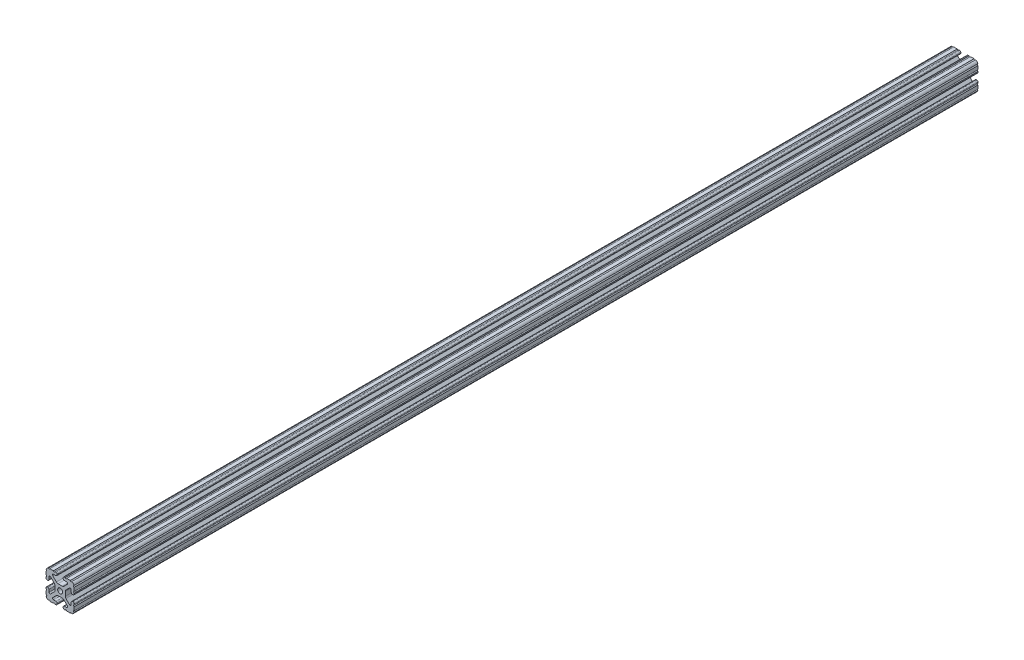
from build123d import *

# Parameters (mm, degrees)
BOSS_EXTRUDE1_DEPTH     = 609.6
CUT_EXTRUDE1_DEPTH      = 611.195022104
CUT_EXTRUDE1_DEPTH_BACK = 611.195022104
SKETCH5_R               = 1.016


with BuildPart() as part:
    # Sketch4 → Boss-Extrude1 (new, symmetric)
    with BuildSketch(Plane.XY):
        with BuildLine():
            Line((5.7912, -19.05), (14.3002, -19.05))
            ThreePointArc((14.3002, -19.05), (17.658815789, -17.658815789), (19.05, -14.3002))
            Line((19.05, -14.3002), (19.05, -5.7912))
            ThreePointArc((19.05, -5.7912), (18.544114832, -4.569885168), (17.3228, -4.064))
            Line((17.3228, -4.064), (16.7132, -4.064))
            ThreePointArc((16.7132, -4.064), (15.491885168, -4.569885168), (14.986, -5.7912))
            Line((14.986, -5.7912), (14.986, -8.996305235))
            ThreePointArc((14.986, -8.996305235), (14.189232738, -10.188751711), (12.782646215, -9.908964256))
            Line((12.782646215, -9.908964256), (7.888897763, -5.015215804))
            ThreePointArc((7.888897763, -5.015215804), (7.219915375, -4.014012907), (6.985, -2.833013566))
            Line((6.985, -2.833013566), (6.985, 0))
            Line((6.985, 0), (3.3274, 0))
            ThreePointArc((3.3274, 0), (2.352827104, -2.352827104), (0, -3.3274))
            Line((0, -3.3274), (0, -6.985))
            Line((0, -6.985), (2.833013566, -6.985))
            ThreePointArc((2.833013566, -6.985), (4.014012907, -7.219915375), (5.015215804, -7.888897763))
            Line((5.015215804, -7.888897763), (9.908964256, -12.782646215))
            ThreePointArc((9.908964256, -12.782646215), (10.188751711, -14.189232738), (8.996305235, -14.986))
            Line((8.996305235, -14.986), (5.7912, -14.986))
            ThreePointArc((5.7912, -14.986), (4.569885168, -15.491885168), (4.064, -16.7132))
            Line((4.064, -16.7132), (4.064, -17.3228))
            ThreePointArc((4.064, -17.3228), (4.569885168, -18.544114832), (5.7912, -19.05))
        make_face()
    extrude(amount=BOSS_EXTRUDE1_DEPTH, both=True)

    # Sketch5 → Cut-Extrude1 (cut, two sides: drawn at the far end of the back side and taken through both)
    with BuildSketch(Plane.XY.offset(-CUT_EXTRUDE1_DEPTH_BACK)):
        with Locations((14.739477062, -19.05)):
            Circle(SKETCH5_R)
        with Locations((7.980305235, -19.05)):
            Circle(SKETCH5_R)
        with Locations((19.05, -14.739477062)):
            Circle(SKETCH5_R)
        with Locations((19.05, -7.980305235)):
            Circle(SKETCH5_R)
    extrude(amount=CUT_EXTRUDE1_DEPTH + CUT_EXTRUDE1_DEPTH_BACK, mode=Mode.SUBTRACT)

    # Mirror1: part across plane


with BuildPart() as part_1:
    add(part.part)
    add(part.part.mirror(Plane(origin=(0, 0, 0), x_dir=(0, 0, 1), z_dir=(1, 0, 0))))

    # Mirror2: part across plane


with BuildPart() as part_2:
    add(part_1.part)
    add(part_1.part.mirror(Plane.ZX))


solid = part_2.part
